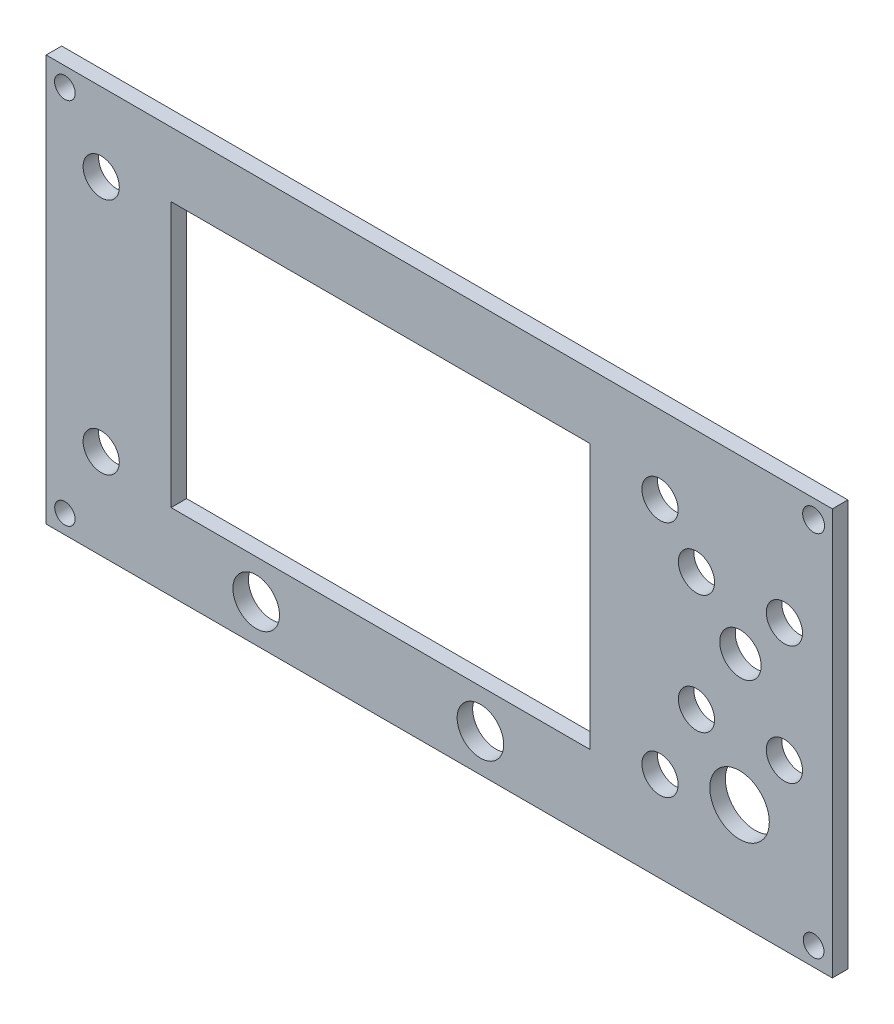
from build123d import *

# Parameters (mm, degrees)
ESQUISSE1_R        = 3.5
ESQUISSE1_R_2      = 4
ESQUISSE1_R_3      = 5.75
ESQUISSE1_R_4      = 4.5
ESQUISSE1_W        = 81
ESQUISSE1_H        = 51.2
BOSS_EXTRU_1_DEPTH = 3
ESQUISSE2_W        = 7.242640687
ESQUISSE2_H        = 7.242640687
ESQUISSE2_R        = 1.965304202
ESQUISSE2_R_2      = 2
ESQUISSE2_R_3      = 2.113486369
BOSS_EXTRU_2_DEPTH = 3


with BuildPart() as part:
    # Esquisse1 → Boss.-Extru.1 (new body)
    with BuildSketch(Plane.XY.offset(0.8)):
        with BuildLine():
            Line((-112.589634865, 39.905491149), (24.864852981, 39.905491149))
            Line((24.864852981, 39.905491149), (24.864852981, 35.662850462))
            ThreePointArc((24.864852981, 35.662850462), (25.743532637, 33.541530119), (27.864852981, 32.662850462))
            Line((27.864852981, 32.662850462), (32.107493668, 32.662850462))
            Line((32.107493668, 32.662850462), (32.107493668, -31.368742114))
            Line((32.107493668, -31.368742114), (27.864852981, -31.368742114))
            ThreePointArc((27.864852981, -31.368742114), (25.743532637, -32.24742177), (24.864852981, -34.368742114))
            Line((24.864852981, -34.368742114), (24.864852981, -38.611382801))
            Line((24.864852981, -38.611382801), (-112.589634865, -38.611382801))
            Line((-112.589634865, -38.611382801), (-112.589634865, -34.368742114))
            ThreePointArc((-112.589634865, -34.368742114), (-113.468314521, -32.24742177), (-115.589634865, -31.368742114))
            Line((-115.589634865, -31.368742114), (-119.832275552, -31.368742114))
            Line((-119.832275552, -31.368742114), (-119.832275552, 32.662850462))
            Line((-119.832275552, 32.662850462), (-115.589634865, 32.662850462))
            ThreePointArc((-115.589634865, 32.662850462), (-113.468314521, 33.541530119), (-112.589634865, 35.662850462))
            Line((-112.589634865, 35.662850462), (-112.589634865, 39.905491149))
        make_face()
        with Locations((-109.194417438, 24.821428571)):
            Circle(ESQUISSE1_R, mode=Mode.SUBTRACT)
        with Locations((-1.194417438, 24.821428571)):
            Circle(ESQUISSE1_R, mode=Mode.SUBTRACT)
        with Locations((-1.194417438, -21.178571429)):
            Circle(ESQUISSE1_R, mode=Mode.SUBTRACT)
        with Locations((-109.194417438, -21.178571429)):
            Circle(ESQUISSE1_R, mode=Mode.SUBTRACT)
        with Locations((14.345224597, 6.749852674)):
            Circle(ESQUISSE1_R_2, mode=Mode.SUBTRACT)
        with Locations((5.845224597, 16.204342535)):
            Circle(ESQUISSE1_R, mode=Mode.SUBTRACT)
        with Locations((22.845224597, 16.204342535)):
            Circle(ESQUISSE1_R, mode=Mode.SUBTRACT)
        with Locations((22.845224597, -6.795657465)):
            Circle(ESQUISSE1_R, mode=Mode.SUBTRACT)
        with Locations((5.845224597, -6.795657465)):
            Circle(ESQUISSE1_R, mode=Mode.SUBTRACT)
        with Locations((14.176552179, -18.611382801)):
            Circle(ESQUISSE1_R_3, mode=Mode.SUBTRACT)
        with Locations((-35.905557573, -31.316718293)):
            Circle(ESQUISSE1_R_4, mode=Mode.SUBTRACT)
        with Locations((-79.237508709, -31.316718293)):
            Circle(ESQUISSE1_R_4, mode=Mode.SUBTRACT)
        with Locations((-55.194417438, 1.821428571)):
            Rectangle(ESQUISSE1_W, ESQUISSE1_H, mode=Mode.SUBTRACT)
    extrude(amount=BOSS_EXTRU_1_DEPTH)

    # Esquisse2 → Boss.-Extru.2 (add)
    # profile 1 of 4: a face of its own
    with BuildSketch(Plane.XY.offset(0.8)):
        with Locations((-116.210955209, -34.990062458)):
            Rectangle(ESQUISSE2_W, ESQUISSE2_H)
        with Locations((-116.210955208, -34.990062458)):
            Circle(ESQUISSE2_R, mode=Mode.SUBTRACT)
    # profile 2 of 4: a face of its own
    with BuildSketch(Plane.XY.offset(0.8)):
        with Locations((-116.210955209, 36.284170805)):
            Rectangle(ESQUISSE2_W, ESQUISSE2_H)
        with Locations((-116.210955208, 36.284170806)):
            Circle(ESQUISSE2_R_2, mode=Mode.SUBTRACT)
    # profile 3 of 4: a face of its own
    with BuildSketch(Plane.XY.offset(0.8)):
        with Locations((28.486173325, 36.284170805)):
            Rectangle(ESQUISSE2_W, ESQUISSE2_H)
        with Locations((28.486173324, 36.284170806)):
            Circle(ESQUISSE2_R_3, mode=Mode.SUBTRACT)
    # profile 4 of 4: a face of its own
    with BuildSketch(Plane.XY.offset(0.8)):
        with Locations((28.486173325, -34.990062458)):
            Rectangle(ESQUISSE2_W, ESQUISSE2_H)
        with Locations((28.486173324, -34.990062458)):
            Circle(ESQUISSE2_R_2, mode=Mode.SUBTRACT)
    extrude(amount=BOSS_EXTRU_2_DEPTH)


solid = part.part
